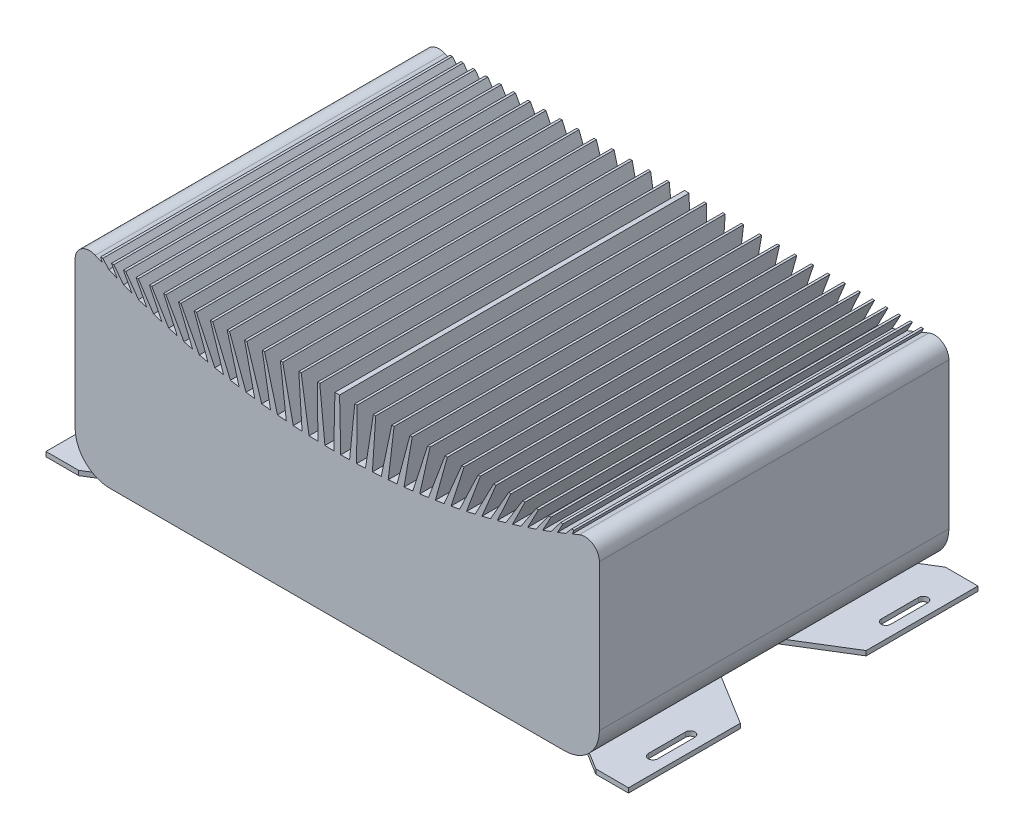
from build123d import *

# Parameters (mm, degrees)
BOSS_EXTRU_1_DEPTH = 150
CONG_1_R           = 15
BOSS_EXTRU_2_DEPTH = 2


with BuildPart() as part:
    # Esquisse1 → Boss.-Extru.1 (new body)
    with BuildSketch(Plane.XY):
        with BuildLine():
            Line((-112.5, 0), (112.5, 0))
            Line((112.5, 0), (112.5, 77.803254504))
            ThreePointArc((112.5, 77.803254504), (109.706079374, 82.982099708), (103.843702056, 83.490983093))
            Line((103.843702056, 83.490983093), (100.822174185, 82.206822173))
            Line((100.822174185, 82.206822173), (101.593849269, 84))
            Line((101.593849269, 84), (100.593849269, 84))
            Line((100.593849269, 84), (98.047294459, 81.066628108))
            Line((98.047294459, 81.066628108), (94.513975375, 79.668180307))
            Line((94.513975375, 79.668180307), (96.868414967, 84))
            Line((96.868414967, 84), (95.868414967, 84))
            Line((95.868414967, 84), (91.710401321, 78.600485349))
            Line((91.710401321, 78.600485349), (88.141932533, 77.29433432))
            Line((88.141932533, 77.29433432), (91.793248094, 84))
            Line((91.793248094, 84), (90.793248094, 84))
            Line((90.793248094, 84), (85.311557961, 76.299859694))
            Line((85.311557961, 76.299859694), (81.710349964, 75.086887739))
            Line((81.710349964, 75.086887739), (86.372418591, 84))
            Line((86.372418591, 84), (85.372418591, 84))
            Line((85.372418591, 84), (78.855086787, 74.166305212))
            Line((78.855086787, 74.166305212), (75.223572191, 73.047331693))
            Line((75.223572191, 73.047331693), (80.613241264, 84))
            Line((80.613241264, 84), (79.613241264, 84))
            Line((79.613241264, 84), (72.345349134, 72.201263116))
            Line((72.345349134, 72.201263116), (68.685981021, 71.177043896))
            Line((68.685981021, 71.177043896), (74.526463538, 84))
            Line((74.526463538, 84), (73.526463538, 84))
            Line((73.526463538, 84), (65.786742319, 70.406060788))
            Line((65.786742319, 70.406060788), (62.101992586, 69.477287727))
            Line((62.101992586, 69.477287727), (68.126397614, 84))
            Line((68.126397614, 84), (67.126397614, 84))
            Line((67.126397614, 84), (59.183696671, 68.781910885))
            Line((59.183696671, 68.781910885), (55.476054359, 67.949211366))
            Line((55.476054359, 67.949211366), (61.430986278, 84))
            Line((61.430986278, 84), (60.430986278, 84))
            Line((60.430986278, 84), (52.540672534, 67.329910517))
            Line((52.540672534, 67.329910517), (48.81264215, 66.593847028))
            Line((48.81264215, 66.593847028), (54.461792967, 84))
            Line((54.461792967, 84), (53.461792967, 84))
            Line((53.461792967, 84), (45.862157261, 66.051040507))
            Line((45.862157261, 66.051040507), (42.116257084, 65.412110258))
            Line((42.116257084, 65.412110258), (47.243908802, 84))
            Line((47.243908802, 84), (46.243908802, 84))
            Line((46.243908802, 84), (39.152662178, 64.946164731))
            Line((39.152662178, 64.946164731), (35.391422557, 64.404799318))
            Line((35.391422557, 64.404799318), (39.805772012, 84))
            Line((39.805772012, 84), (38.805772012, 84))
            Line((38.805772012, 84), (32.416719538, 64.01602953))
            Line((32.416719538, 64.01602953), (28.642681183, 63.572594644))
            Line((28.642681183, 63.572594644), (32.178898512, 84))
            Line((32.178898512, 84), (31.178898512, 84))
            Line((31.178898512, 84), (25.658879458, 63.261263209))
            Line((25.658879458, 63.261263209), (21.874591726, 62.91605839))
            Line((21.874591726, 62.91605839), (24.397526133, 84))
            Line((24.397526133, 84), (23.397526133, 84))
            Line((23.397526133, 84), (18.883706848, 62.682375611))
            Line((18.883706848, 62.682375611), (15.09172602, 62.435634044))
            Line((15.09172602, 62.435634044), (16.498178932, 84))
            Line((16.498178932, 84), (15.498178932, 84))
            Line((15.498178932, 84), (12.095778325, 62.279757774))
            Line((12.095778325, 62.279757774), (8.298665877, 62.131646133))
            Line((8.298665877, 62.131646133), (8.519161913, 84))
            Line((8.519161913, 84), (7.519161913, 84))
            Line((7.519161913, 84), (5.299679125, 62.053681665))
            Line((5.299679125, 62.053681665), (1.5, 62.004299999))
            Line((1.5, 62.004299999), (1, 84))
            Line((1, 84), (-1, 84))
            Line((-1, 84), (-1.5, 62.004299999))
            Line((-1.5, 62.004299999), (-5.299679125, 62.053681665))
            Line((-5.299679125, 62.053681665), (-7.519161913, 84))
            Line((-7.519161913, 84), (-8.519161913, 84))
            Line((-8.519161913, 84), (-8.298665877, 62.131646133))
            Line((-8.298665877, 62.131646133), (-12.095778325, 62.279757774))
            Line((-12.095778325, 62.279757774), (-15.498178932, 84))
            Line((-15.498178932, 84), (-16.498178932, 84))
            Line((-16.498178932, 84), (-15.09172602, 62.435634044))
            Line((-15.09172602, 62.435634044), (-18.883706848, 62.682375611))
            Line((-18.883706848, 62.682375611), (-23.397526133, 84))
            Line((-23.397526133, 84), (-24.397526133, 84))
            Line((-24.397526133, 84), (-21.874591726, 62.91605839))
            Line((-21.874591726, 62.91605839), (-25.658879458, 63.261263209))
            Line((-25.658879458, 63.261263209), (-31.178898512, 84))
            Line((-31.178898512, 84), (-32.178898512, 84))
            Line((-32.178898512, 84), (-28.642681183, 63.572594644))
            Line((-28.642681183, 63.572594644), (-32.416719538, 64.01602953))
            Line((-32.416719538, 64.01602953), (-38.805772012, 84))
            Line((-38.805772012, 84), (-39.805772012, 84))
            Line((-39.805772012, 84), (-35.391422557, 64.404799318))
            Line((-35.391422557, 64.404799318), (-39.152662178, 64.946164731))
            Line((-39.152662178, 64.946164731), (-46.243908802, 84))
            Line((-46.243908802, 84), (-47.243908802, 84))
            Line((-47.243908802, 84), (-42.116257084, 65.412110258))
            Line((-42.116257084, 65.412110258), (-45.862157261, 66.051040507))
            Line((-45.862157261, 66.051040507), (-53.461792967, 84))
            Line((-53.461792967, 84), (-54.461792967, 84))
            Line((-54.461792967, 84), (-48.81264215, 66.593847028))
            Line((-48.81264215, 66.593847028), (-52.540672534, 67.329910517))
            Line((-52.540672534, 67.329910517), (-60.430986278, 84))
            Line((-60.430986278, 84), (-61.430986278, 84))
            Line((-61.430986278, 84), (-55.476054359, 67.949211366))
            Line((-55.476054359, 67.949211366), (-59.183696671, 68.781910885))
            Line((-59.183696671, 68.781910885), (-67.126397614, 84))
            Line((-67.126397614, 84), (-68.126397614, 84))
            Line((-68.126397614, 84), (-62.101992586, 69.477287727))
            Line((-62.101992586, 69.477287727), (-65.786742319, 70.406060788))
            Line((-65.786742319, 70.406060788), (-73.526463538, 84))
            Line((-73.526463538, 84), (-74.526463538, 84))
            Line((-74.526463538, 84), (-68.685981021, 71.177043896))
            Line((-68.685981021, 71.177043896), (-72.345349134, 72.201263116))
            Line((-72.345349134, 72.201263116), (-79.613241264, 84))
            Line((-79.613241264, 84), (-80.613241264, 84))
            Line((-80.613241264, 84), (-75.223572191, 73.047331693))
            Line((-75.223572191, 73.047331693), (-78.855086787, 74.166305212))
            Line((-78.855086787, 74.166305212), (-85.372418591, 84))
            Line((-85.372418591, 84), (-86.372418591, 84))
            Line((-86.372418591, 84), (-81.710349964, 75.086887739))
            Line((-81.710349964, 75.086887739), (-85.311557961, 76.299859694))
            Line((-85.311557961, 76.299859694), (-90.793248094, 84))
            Line((-90.793248094, 84), (-91.793248094, 84))
            Line((-91.793248094, 84), (-88.141932533, 77.29433432))
            Line((-88.141932533, 77.29433432), (-91.710401321, 78.600485349))
            Line((-91.710401321, 78.600485349), (-95.868414967, 84))
            Line((-95.868414967, 84), (-96.868414967, 84))
            Line((-96.868414967, 84), (-94.513975375, 79.668180307))
            Line((-94.513975375, 79.668180307), (-98.047294459, 81.066628108))
            Line((-98.047294459, 81.066628108), (-100.593849269, 84))
            Line((-100.593849269, 84), (-101.593849269, 84))
            Line((-101.593849269, 84), (-100.822174185, 82.206822173))
            Line((-100.822174185, 82.206822173), (-103.843702056, 83.490983093))
            ThreePointArc((-103.843702056, 83.490983093), (-109.706079374, 82.982099708), (-112.5, 77.803254504))
            Line((-112.5, 77.803254504), (-112.5, 0))
        make_face()
    extrude(amount=BOSS_EXTRU_1_DEPTH)

    # Congé1
    cong_1_edges = [part.edges().sort_by_distance(p)[0] for p in [
        (112.5, 0, 75),
        (-112.5, 0, 75),
    ]]
    fillet(cong_1_edges, radius=CONG_1_R)

    # Esquisse2 → Boss.-Extru.2 (add)
    # profile 1 of 2: a face of its own
    with BuildSketch(Plane.XZ):
        Polygon((85, 134), (111, 150), (125, 150), (125, 102), (99, 86), (99, 64), (125, 48), (125, 0), (111, 0), (85, 16), (85, 34.748316978), align=None)
        with BuildLine():
            Line((120.5, 133), (120.5, 117))
            ThreePointArc((120.5, 117), (118.5, 115), (116.5, 117))
            Line((116.5, 117), (116.5, 133))
            ThreePointArc((116.5, 133), (118.5, 135), (120.5, 133))
        make_face(mode=Mode.SUBTRACT)
        with BuildLine():
            Line((120.5, 17), (120.5, 33))
            ThreePointArc((120.5, 33), (118.5, 35), (116.5, 33))
            Line((116.5, 33), (116.5, 17))
            ThreePointArc((116.5, 17), (118.5, 15), (120.5, 17))
        make_face(mode=Mode.SUBTRACT)
    # profile 2 of 2: a face of its own
    with BuildSketch(Plane.XZ):
        Polygon((-85, 34.748316978), (-85, 134), (-111, 150), (-125, 150), (-125, 102), (-99, 86), (-99, 64), (-125, 48), (-125, 0), (-111, 0), (-85, 16), align=None)
        with BuildLine():
            Line((-120.5, 133), (-120.5, 117))
            ThreePointArc((-120.5, 117), (-118.5, 115), (-116.5, 117))
            Line((-116.5, 117), (-116.5, 133))
            ThreePointArc((-116.5, 133), (-118.5, 135), (-120.5, 133))
        make_face(mode=Mode.SUBTRACT)
        with BuildLine():
            Line((-120.5, 17), (-120.5, 33))
            ThreePointArc((-120.5, 33), (-118.5, 35), (-116.5, 33))
            Line((-116.5, 33), (-116.5, 17))
            ThreePointArc((-116.5, 17), (-118.5, 15), (-120.5, 17))
        make_face(mode=Mode.SUBTRACT)
    extrude(amount=BOSS_EXTRU_2_DEPTH)


solid = part.part
